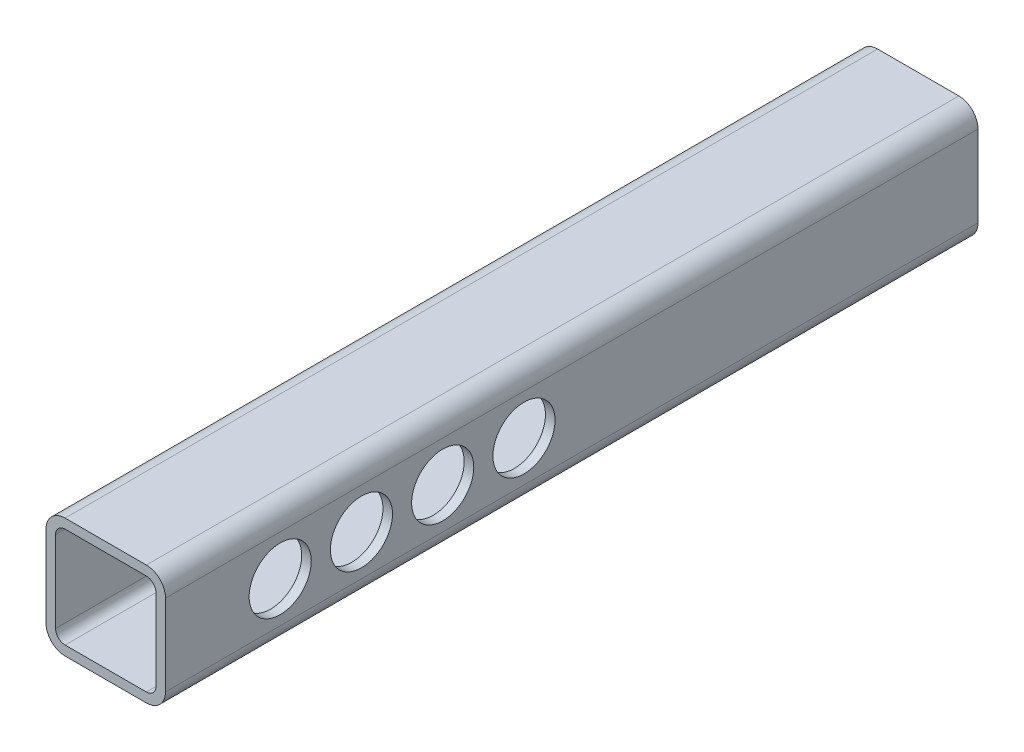
from build123d import *

# Parameters (mm, degrees)
EXTRUDE_1_DEPTH     = 170
SKETCH_2_R          = 6.5
CUT_EXTRUDE_1_DEPTH = 173.28247154


with BuildPart() as part:
    # Эскиз1 → Бобышка-Вытянуть1 (new body)
    with BuildSketch(Plane.XY):
        with BuildLine():
            Line((8.5, -12.5), (-8.5, -12.5))
            ThreePointArc((-8.5, -12.5), (-11.328427125, -11.328427125), (-12.5, -8.5))
            Line((-12.5, -8.5), (-12.5, 8.5))
            ThreePointArc((-12.5, 8.5), (-11.328427125, 11.328427125), (-8.5, 12.5))
            Line((-8.5, 12.5), (8.5, 12.5))
            ThreePointArc((8.5, 12.5), (11.328427125, 11.328427125), (12.5, 8.5))
            Line((12.5, 8.5), (12.5, -8.5))
            ThreePointArc((12.5, -8.5), (11.328427125, -11.328427125), (8.5, -12.5))
        make_face()
        with BuildLine():
            Line((-10.5, -8.5), (-10.5, 8.5))
            ThreePointArc((-10.5, 8.5), (-9.914213562, 9.914213562), (-8.5, 10.5))
            Line((-8.5, 10.5), (8.5, 10.5))
            ThreePointArc((8.5, 10.5), (9.914213562, 9.914213562), (10.5, 8.5))
            Line((10.5, 8.5), (10.5, -8.5))
            ThreePointArc((10.5, -8.5), (9.914213562, -9.914213562), (8.5, -10.5))
            Line((8.5, -10.5), (-8.5, -10.5))
            ThreePointArc((-8.5, -10.5), (-9.914213562, -9.914213562), (-10.5, -8.5))
        make_face(mode=Mode.SUBTRACT)
    extrude(amount=EXTRUDE_1_DEPTH)

    # Эскиз2 → Вырез-Вытянуть1 (cut, through all)
    with BuildSketch(Plane(origin=(12.5, 0, 0), x_dir=(0, 0, -1), z_dir=(1, 0, 0))):
        with Locations((-146, 0)):
            Circle(SKETCH_2_R)
        with Locations((-129, 0)):
            Circle(SKETCH_2_R)
        with Locations((-112, 0)):
            Circle(SKETCH_2_R)
        with Locations((-95, 0)):
            Circle(SKETCH_2_R)
    extrude(amount=-CUT_EXTRUDE_1_DEPTH, mode=Mode.SUBTRACT)


solid = part.part
